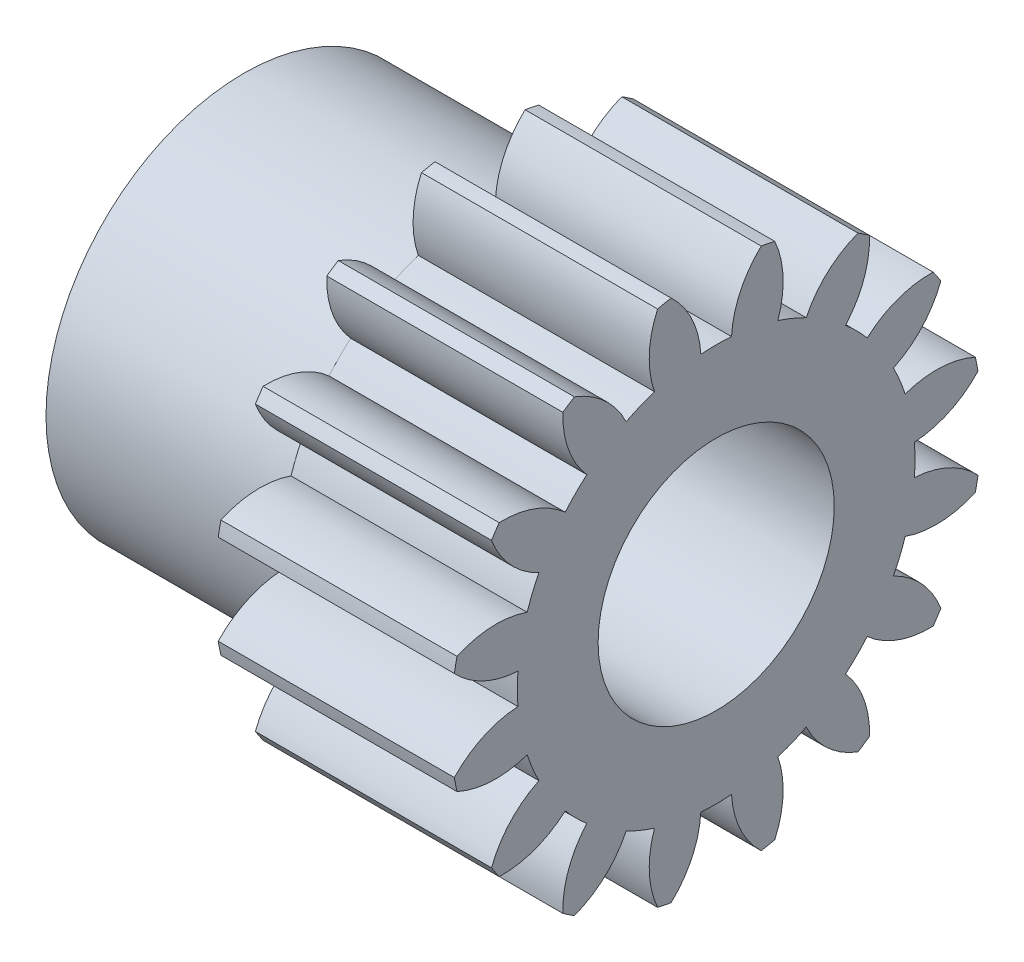
from build123d import *

# Parameters (mm, degrees)
BASPROSKE_W      = 6.35
BASPROSKE_H      = 7.14375
TOOTHCUT_DEPTH   = 12.932679
TEETHCUTS_COUNT  = 16
TEETHCUTS_ANGLE  = 337.5
HUBNEAONESKE_R   = 5.3213
HUBNEARONE_DEPTH = 6.3500508
BORSKE_R         = 3.175
BORE_DEPTH       = 6.3500508


with BuildPart() as part:
    # BasProSke → Base-Revolve (revolve)
    with BuildSketch(Plane(origin=(0, 0, 0), x_dir=(1, 0, 0), z_dir=(0, 1, 0)), mode=Mode.PRIVATE) as base_revolve_sk:
        with Locations((3.175, 3.571875)):
            Rectangle(BASPROSKE_W, BASPROSKE_H)
    revolve(base_revolve_sk.sketch.rotate(Axis((-10, 0, 0), (1, 0, 0)), 180), axis=Axis((-10, 0, 0), (1, 0, 0)))

    # TooCutSke → ToothCut (cut, through all)
    with BuildSketch(Plane(origin=(0, 0, 0), x_dir=(0, 0, -1), z_dir=(1, 0, 0))):
        with BuildLine():
            ThreePointArc((0.412624286, 5.330754364), (0, 5.3467), (-0.412624286, 5.330754364))
            ThreePointArc((-0.412624286, 5.330754364), (-0.654009481, 6.276897321), (-1.23450033, 7.062062068))
            ThreePointArc((-1.23450033, 7.062062068), (0, 7.16915), (1.23450033, 7.062062068))
            ThreePointArc((1.23450033, 7.062062068), (0.654009481, 6.276897321), (0.412624286, 5.330754364))
        make_face()
    toothcut = extrude(amount=TOOTHCUT_DEPTH, mode=Mode.SUBTRACT)

    # TeethCuts: ToothCut ×16 about axis
    teethcuts_axis = Axis((-10, 0, 0), (1, 0, 0))
    for i in range(1, TEETHCUTS_COUNT):
        add(toothcut.rotate(teethcuts_axis, i * TEETHCUTS_ANGLE / (TEETHCUTS_COUNT - 1)), mode=Mode.SUBTRACT)

    # HubNeaOneSke → HubNearOne (add)
    with BuildSketch(Plane.ZY):
        with Locations(Location((0, 0, 0), (0, 0, 180))):
            Circle(HUBNEAONESKE_R)
    extrude(amount=HUBNEARONE_DEPTH)

    # BorSke → Bore (cut, symmetric)
    with BuildSketch(Plane(origin=(0, 0, 0), x_dir=(0, 0, -1), z_dir=(1, 0, 0))):
        with Locations(Location((0, 0, 0), (0, 0, 180))):
            Circle(BORSKE_R)
    extrude(amount=BORE_DEPTH, both=True, mode=Mode.SUBTRACT)


solid = part.part
